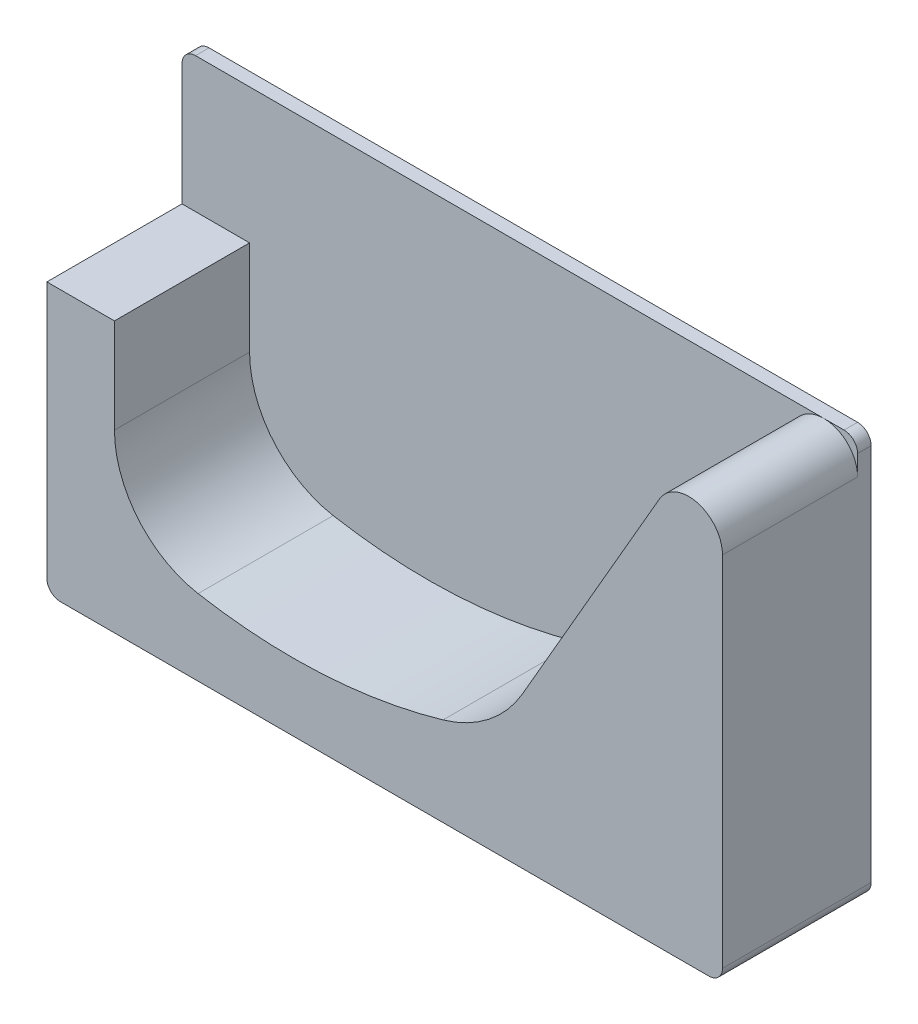
from build123d import *

# Parameters (mm, degrees)
CROQUIS1_W              = 100
CROQUIS1_H              = 60
SALIENTE_EXTRUIR1_DEPTH = 2
REDONDEO1_R             = 2
SALIENTE_EXTRUIR2_START = 20
SALIENTE_EXTRUIR2_DEPTH = 20


with BuildPart() as part:
    # Croquis1 → Saliente-Extruir1 (new body)
    with BuildSketch(Plane.XY):
        with Locations((50, 30)):
            Rectangle(CROQUIS1_W, CROQUIS1_H)
    extrude(amount=SALIENTE_EXTRUIR1_DEPTH)

    # Redondeo1
    redondeo1_edges = [part.edges().sort_by_distance(p)[0] for p in [
        (0, 60, 1),
        (100, 60, 1),
        (100, 0, 1),
        (0, 0, 1),
    ]]
    fillet(redondeo1_edges, radius=REDONDEO1_R)

    # Croquis2 → Saliente-Extruir2 (add)
    with BuildSketch(Plane.XY.offset(2).offset(SALIENTE_EXTRUIR2_START)):
        with BuildLine():
            Line((70.390057163, 22.374328634), (90.669872981, 57.5))
            ThreePointArc((90.669872981, 57.5), (96.294095226, 59.829629131), (100, 55))
            Line((100, 55), (100, 2))
            ThreePointArc((100, 2), (99.414213562, 0.585786438), (98, 0))
            Line((98, 0), (2, 0))
            ThreePointArc((2, 0), (0.585786438, 0.585786438), (0, 2))
            Line((0, 2), (0, 40))
            Line((0, 40), (10, 40))
            Line((10, 40), (10, 26))
            ThreePointArc((10, 26), (13.504011149, 16.364532168), (22.378965379, 11.230769231))
            ThreePointArc((22.378965379, 11.230769231), (40.620786832, 10.113661458), (58.640126552, 13.165771512))
            ThreePointArc((58.640126552, 13.165771512), (65.406478623, 16.632658786), (70.390057163, 22.374328634))
        make_face()
    extrude(amount=-SALIENTE_EXTRUIR2_DEPTH)


solid = part.part
